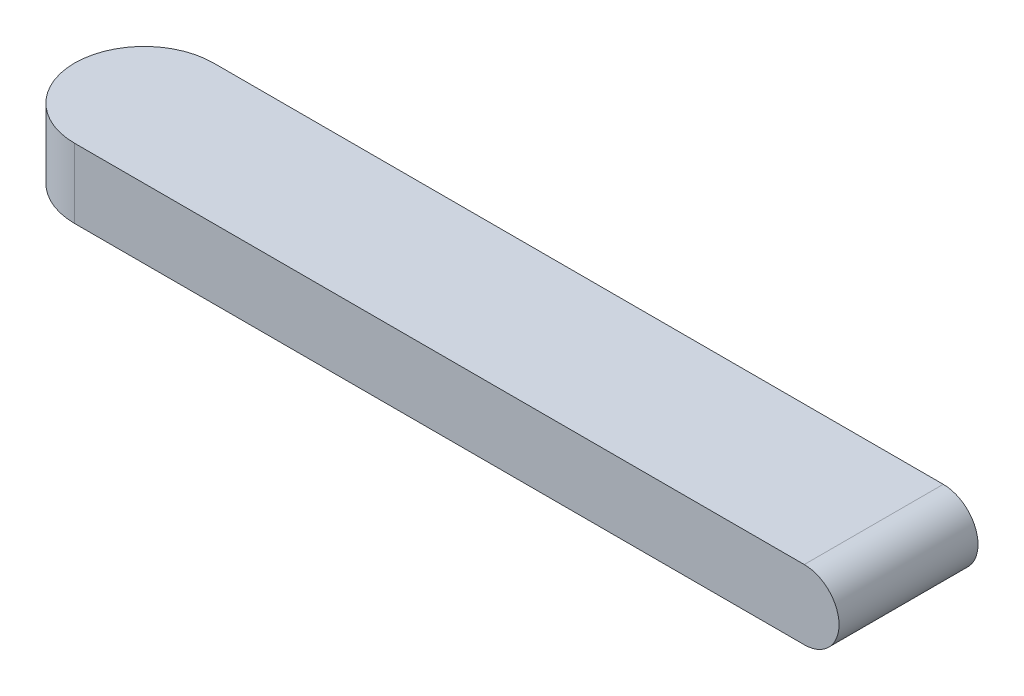
from build123d import *

# Parameters (mm, degrees)
SKETCH1_W           = 12
SKETCH1_H           = 1
BOSS_EXTRUDE1_DEPTH = 2
FILLET1_RADIUS      = 1
FILLET1_LENGTH      = 1
FILLET2_RADIUS      = 0.5
FILLET2_LENGTH      = 2


with BuildPart() as part:
    # Sketch1 → Boss-Extrude1 (new body)
    with BuildSketch(Plane.XY):
        Rectangle(SKETCH1_W, SKETCH1_H)
    extrude(amount=BOSS_EXTRUDE1_DEPTH)

    # Fillet1: full round fillet: the end face becomes a half cylinder, R = half its width
    fillet1_face = Plane((-6, 0, 1), x_dir=(0, 1, 0), z_dir=(-1, 0, 0))  # on the end face: x along it, z out of the body
    fillet1_slab = fillet1_face.offset(-FILLET1_RADIUS / 2) * Box(FILLET1_LENGTH, 2 * FILLET1_RADIUS, FILLET1_RADIUS, mode=Mode.PRIVATE)  # the body's end, R deep
    fillet1_round = Plane((-5, 0, 1), x_dir=(-1, 0, 0), z_dir=(0, 1, 0)) * Cylinder(FILLET1_RADIUS, FILLET1_LENGTH, mode=Mode.PRIVATE)  # its axis R under the face
    add(fillet1_slab - fillet1_round, mode=Mode.SUBTRACT)

    # Fillet2: full round fillet: the end face becomes a half cylinder, R = half its width
    fillet2_face = Plane((6, 0, 1), x_dir=(0, 0, 1), z_dir=(1, 0, 0))  # on the end face: x along it, z out of the body
    fillet2_slab = fillet2_face.offset(-FILLET2_RADIUS / 2) * Box(FILLET2_LENGTH, 2 * FILLET2_RADIUS, FILLET2_RADIUS, mode=Mode.PRIVATE)  # the body's end, R deep
    fillet2_round = Plane((5.5, 0, 1), x_dir=(1, 0, 0), z_dir=(0, 0, 1)) * Cylinder(FILLET2_RADIUS, FILLET2_LENGTH, mode=Mode.PRIVATE)  # its axis R under the face
    add(fillet2_slab - fillet2_round, mode=Mode.SUBTRACT)


solid = part.part
